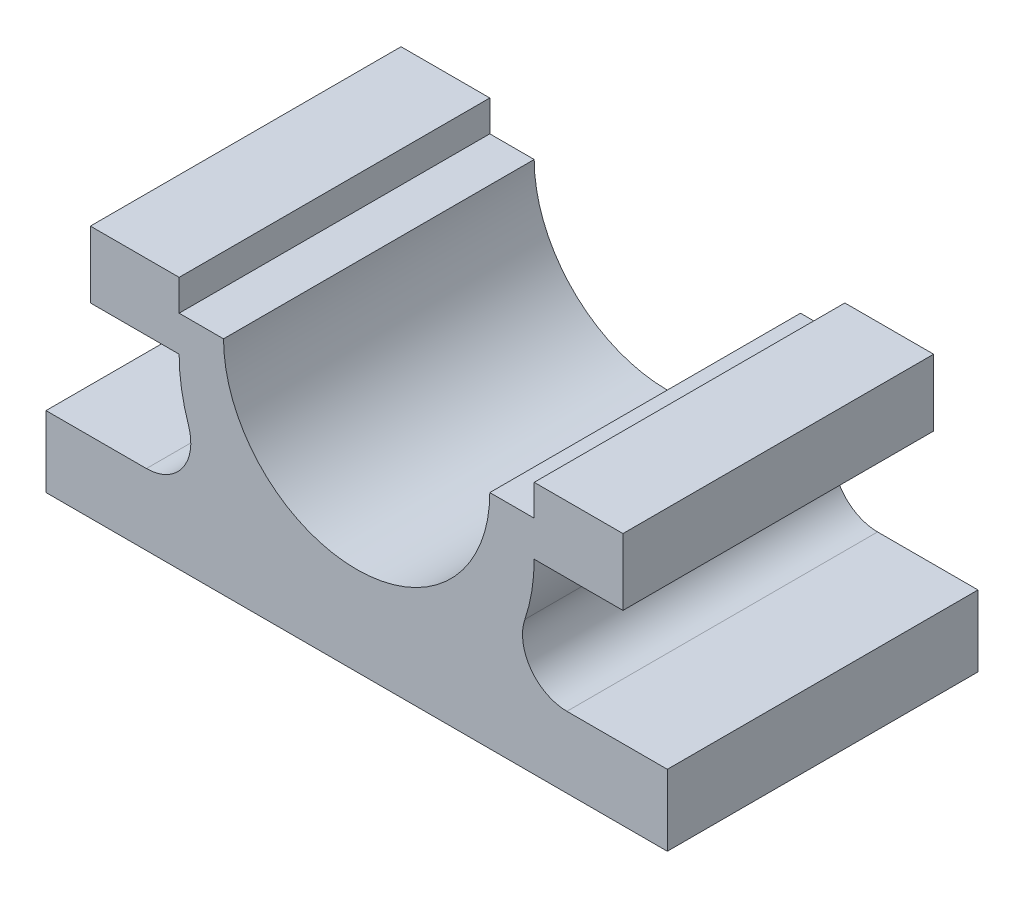
from build123d import *

# Parameters (mm, degrees)
SALIENTE_EXTRUIR1_DEPTH = 105


with BuildPart() as part:
    # Croquis1 → Saliente-Extruir1 (new, symmetric)
    with BuildSketch(Plane.XY):
        with BuildLine():
            Line((-90, 0), (-120, 0))
            Line((-120, 0), (-120, 21))
            Line((-120, 21), (-180, 21))
            Line((-180, 21), (-180, -24))
            Line((-180, -24), (-120, -24))
            ThreePointArc((-120, -24), (-118.412019266, -43.457484251), (-113.69010511, -62.4))
            ThreePointArc((-113.69010511, -62.4), (-117.740516174, -89.492855685), (-142.112631388, -102))
            Line((-142.112631388, -102), (-210, -102))
            Line((-210, -102), (-210, -150))
            Line((-210, -150), (210, -150))
            Line((210, -150), (210, -102))
            Line((210, -102), (142.112631388, -102))
            ThreePointArc((142.112631388, -102), (117.740516174, -89.492855685), (113.69010511, -62.4))
            ThreePointArc((113.69010511, -62.4), (118.412019266, -43.457484251), (120, -24))
            Line((120, -24), (180, -24))
            Line((180, -24), (180, 21))
            Line((180, 21), (120, 21))
            Line((120, 21), (120, 0))
            Line((120, 0), (90, 0))
            ThreePointArc((90, 0), (0, -90), (-90, 0))
        make_face()
    extrude(amount=SALIENTE_EXTRUIR1_DEPTH, both=True)


solid = part.part
